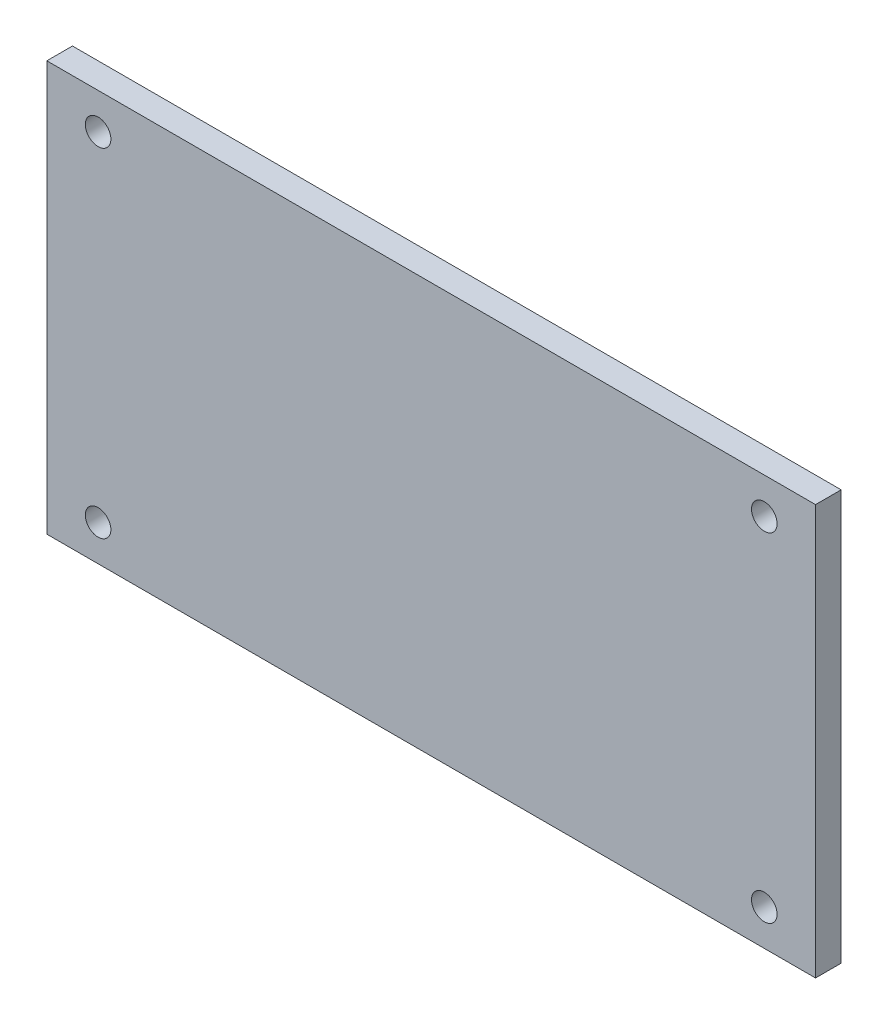
from build123d import *

# Parameters (mm, degrees)
SKETCH1_W           = 150
SKETCH1_H           = 80
SKETCH1_R           = 2.5
BOSS_EXTRUDE1_DEPTH = 5


with BuildPart() as part:
    # Sketch1 → Boss-Extrude1 (new body)
    with BuildSketch(Plane.XY):
        with Locations((0, 10)):
            Rectangle(SKETCH1_W, SKETCH1_H)
        with Locations((-65, 43)):
            Circle(SKETCH1_R, mode=Mode.SUBTRACT)
        with Locations(Location((65, 43, 0), (0, 0, 180))):
            Circle(SKETCH1_R, mode=Mode.SUBTRACT)
        with Locations((65, -23)):
            Circle(SKETCH1_R, mode=Mode.SUBTRACT)
        with Locations(Location((-65, -23, 0), (0, 0, 180))):
            Circle(SKETCH1_R, mode=Mode.SUBTRACT)
    extrude(amount=BOSS_EXTRUDE1_DEPTH)


solid = part.part
